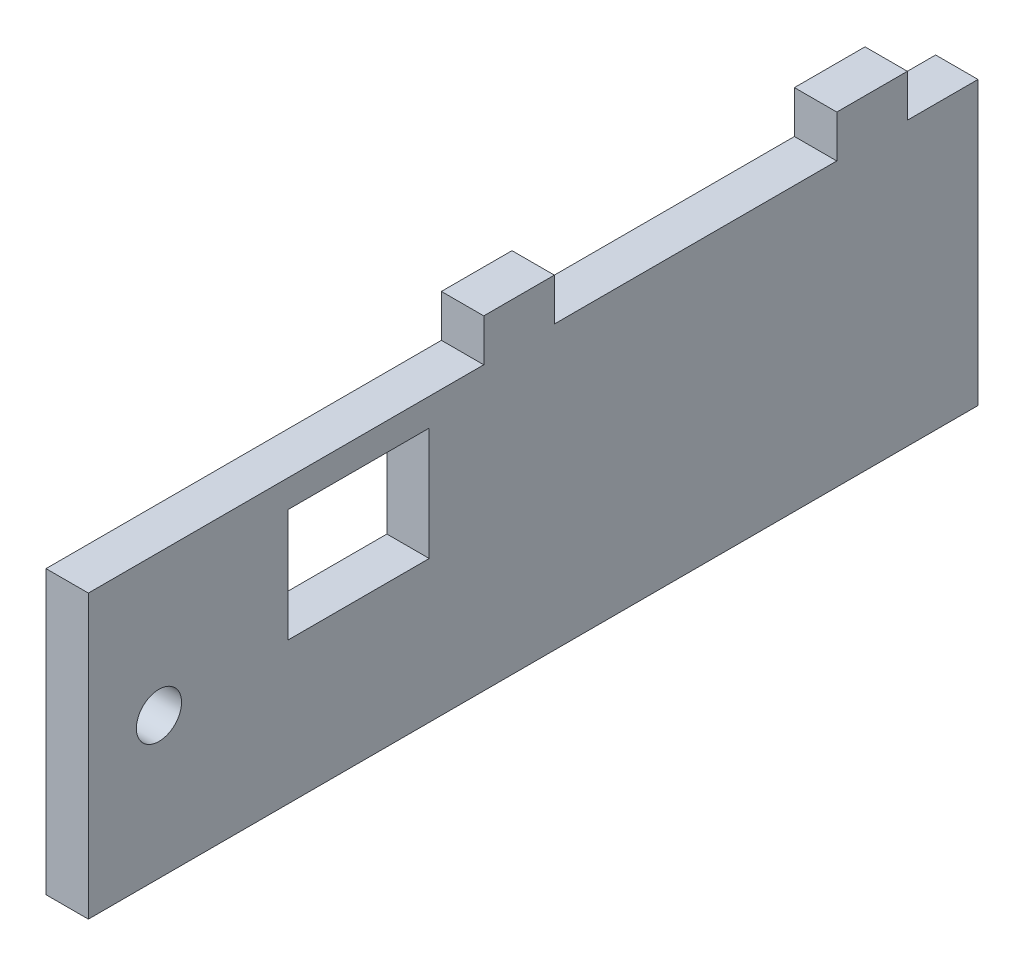
from build123d import *

# Parameters (mm, degrees)
SKETCH_1_R      = 1.6
SKETCH_1_W      = 10
SKETCH_1_H      = 8
EXTRUDE_1_DEPTH = 3


with BuildPart() as part:
    # ｽｹｯﾁ1 → ﾎﾞｽ - 押し出し1 (new body)
    with BuildSketch(Plane(origin=(0, 0, 0), x_dir=(0, 0, -1), z_dir=(1, 0, 0))):
        Polygon((17, 27), (17, 7), (80, 7), (80, 27), (75, 27), (75, 30), (70, 30), (70, 27), (50, 27), (50, 30), (45, 30), (45, 27), align=None)
        with Locations((22, 17)):
            Circle(SKETCH_1_R, mode=Mode.SUBTRACT)
        with Locations((36.14, 21.05)):
            Rectangle(SKETCH_1_W, SKETCH_1_H, mode=Mode.SUBTRACT)
    extrude(amount=EXTRUDE_1_DEPTH)


solid = part.part
